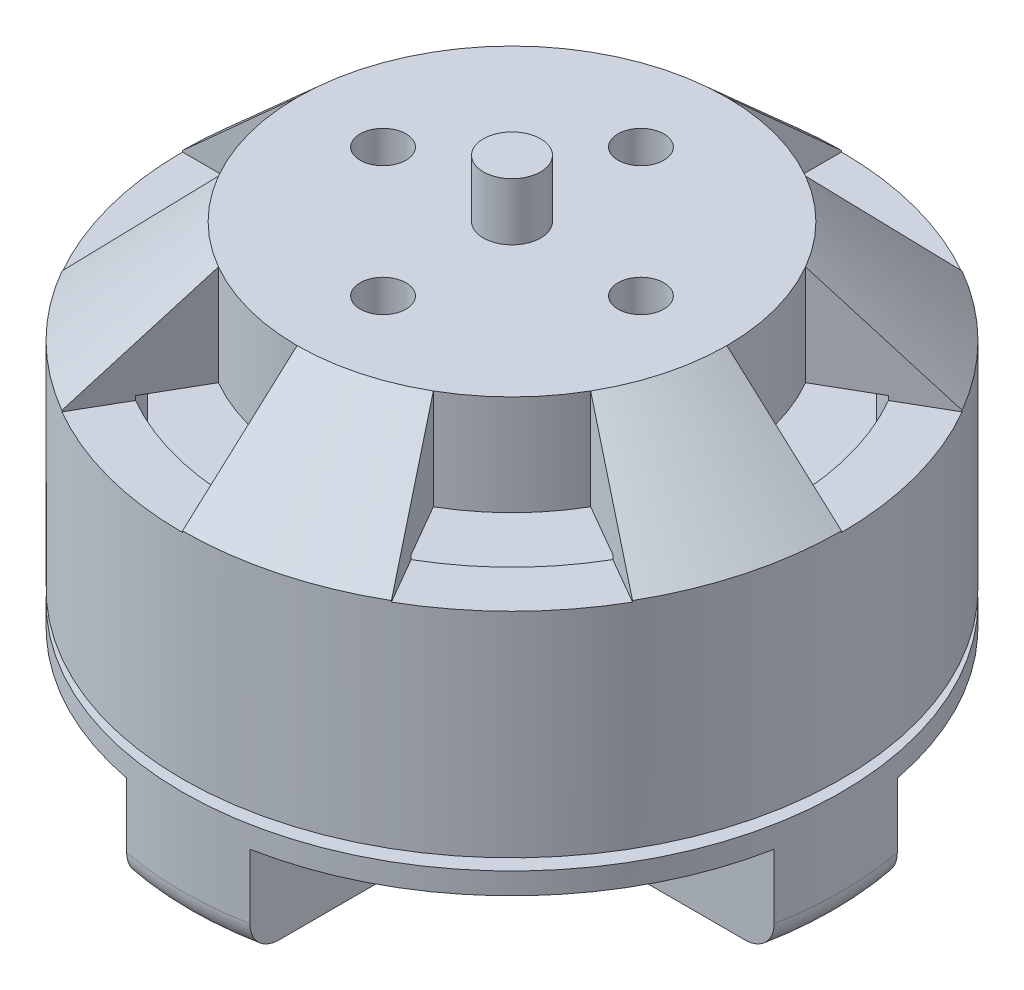
from build123d import *

# Parameters (mm, degrees)
SKETCH1_R                  = 11.5
BOSS_EXTRUDE1_DEPTH        = 4
BOSS_EXTRUDE2_DEPTH        = 6
SKETCH3_R                  = 1
CUT_EXTRUDE1_DEPTH         = 3.25
CUT_EXTRUDE2_START         = -3.65
CUT_EXTRUDE2_DEPTH         = 3.65
CUT_EXTRUDE3_DEPTH         = 0.75
FILLET1_R                  = 1
M2_TAPPED_HOLE1_AT_2_COUNT = 2
M2_TAPPED_HOLE1_AT_2_PITCH = 6.363961031
M2_TAPPED_HOLE1_AT_3_COUNT = 2
M2_TAPPED_HOLE1_AT_3_PITCH = 9
M2_TAPPED_HOLE1_AT_4_COUNT = 2
M2_TAPPED_HOLE1_AT_4_PITCH = 6.363961031


with BuildPart() as part:
    # Sketch1 → Boss-Extrude1 (new body)
    with BuildSketch(Plane(origin=(0, 0, 0), x_dir=(1, 0, 0), z_dir=(0, 1, 0))):
        with Locations(Location((0, 0, 0), (0, 0, 270))):
            Circle(SKETCH1_R)
    extrude(amount=BOSS_EXTRUDE1_DEPTH)

    # Sketch3 → Cut-Extrude1 (cut)
    with BuildSketch(Plane.XZ):
        with Locations(Location((0, 8, 0), (0, 0, 270))):
            Circle(SKETCH3_R)
        with Locations(Location((6, 0, 0), (0, 0, 270))):
            Circle(SKETCH3_R)
        with Locations(Location((0, -8, 0), (0, 0, 270))):
            Circle(SKETCH3_R)
        with Locations(Location((-6, 0, 0), (0, 0, 270))):
            Circle(SKETCH3_R)
        with BuildLine():
            Line((-2.15, 11.297234175), (-2.15, 4.65))
            ThreePointArc((-2.15, 4.65), (-2.882233047, 2.882233047), (-4.65, 2.15))
            Line((-4.65, 2.15), (-11.297234175, 2.15))
            ThreePointArc((-11.297234175, 2.15), (-8.131727984, 8.131727984), (-2.15, 11.297234175))
        make_face()
        with BuildLine():
            Line((2.15, 11.297234175), (2.15, 4.65))
            ThreePointArc((2.15, 4.65), (2.882233047, 2.882233047), (4.65, 2.15))
            Line((4.65, 2.15), (11.297234175, 2.15))
            ThreePointArc((11.297234175, 2.15), (8.131727984, 8.131727984), (2.15, 11.297234175))
        make_face()
        with BuildLine():
            Line((11.297234175, -2.15), (4.65, -2.15))
            ThreePointArc((4.65, -2.15), (2.882233047, -2.882233047), (2.15, -4.65))
            Line((2.15, -4.65), (2.15, -11.297234175))
            ThreePointArc((2.15, -11.297234175), (8.131727984, -8.131727984), (11.297234175, -2.15))
        make_face()
        with BuildLine():
            Line((-2.15, -4.65), (-2.15, -11.297234175))
            ThreePointArc((-2.15, -11.297234175), (-8.131727984, -8.131727984), (-11.297234175, -2.15))
            Line((-11.297234175, -2.15), (-4.65, -2.15))
            ThreePointArc((-4.65, -2.15), (-2.882233047, -2.882233047), (-2.15, -4.65))
        make_face()
    extrude(amount=-CUT_EXTRUDE1_DEPTH, mode=Mode.SUBTRACT)

    # Sketch9 → Cut-Extrude3 (cut)
    with BuildSketch(Plane.XZ.offset(-3.25)):
        with BuildLine():
            Line((-4.65, -2.15), (-9.253512846, -2.15))
            ThreePointArc((-9.253512846, -2.15), (-6.717514421, -6.717514421), (-2.15, -9.253512846))
            Line((-2.15, -9.253512846), (-2.15, -4.65))
            ThreePointArc((-2.15, -4.65), (-2.882233047, -2.882233047), (-4.65, -2.15))
        make_face()
        with BuildLine():
            Line((2.15, -4.65), (2.15, -9.253512846))
            ThreePointArc((2.15, -9.253512846), (6.717514421, -6.717514421), (9.253512846, -2.15))
            Line((9.253512846, -2.15), (4.65, -2.15))
            ThreePointArc((4.65, -2.15), (2.882233047, -2.882233047), (2.15, -4.65))
        make_face()
        with BuildLine():
            Line((4.65, 2.15), (9.253512846, 2.15))
            ThreePointArc((9.253512846, 2.15), (6.717514421, 6.717514421), (2.15, 9.253512846))
            Line((2.15, 9.253512846), (2.15, 4.65))
            ThreePointArc((2.15, 4.65), (2.882233047, 2.882233047), (4.65, 2.15))
        make_face()
        with BuildLine():
            Line((-2.15, 4.65), (-2.15, 9.253512846))
            ThreePointArc((-2.15, 9.253512846), (-6.717514421, 6.717514421), (-9.253512846, 2.15))
            Line((-9.253512846, 2.15), (-4.65, 2.15))
            ThreePointArc((-4.65, 2.15), (-2.882233047, 2.882233047), (-2.15, 4.65))
        make_face()
    extrude(amount=-CUT_EXTRUDE3_DEPTH, mode=Mode.SUBTRACT)

    # Fillet1
    fillet1_edges = [part.edges().sort_by_distance(p)[0] for p in [
        (11.5, 0, 0),
        (0, 0, -11.5),
        (-11.5, 0, 0),
        (1.079770112, 0, 11.449196326),
    ]]
    fillet(fillet1_edges, radius=FILLET1_R)


with BuildPart() as body_2:
    # Sketch2 → Boss-Extrude2 (new body)
    with BuildSketch(Plane(origin=(0, 4, 0), x_dir=(1, 0, 0), z_dir=(0, 1, 0))):
        Polygon((0, -9.317485624), (4.658742812, -8.06917925), (8.06917925, -4.658742812), (9.317485624, 0), (8.06917925, 4.658742812), (4.658742812, 8.06917925), (0, 9.317485624), (-4.658742812, 8.06917925), (-8.06917925, 4.658742812), (-9.317485624, 0), (-8.06917925, -4.658742812), (-4.658742812, -8.06917925), align=None)
    extrude(amount=BOSS_EXTRUDE2_DEPTH)


with BuildPart() as body_3:
    # Sketch4 → Revolve2 (revolve)
    with BuildSketch(Plane(origin=(0, 0, 0), x_dir=(0, 0, -1), z_dir=(1, 0, 0))):
        Polygon((-11.5, 4.397620361), (-11.5, 11.897620361), (-7.5, 15.5), (-1, 15.5), (-1, 17.5), (0, 17.5), (0, 15.5), (0, 11), (0, 10), (-1, 10), (-1, 12), (-9.617485624, 12), (-9.617485624, 4.397620361), align=None)
    revolve(axis=Axis((0, 19.11668492, 0), (0, -1, 0)))

    # Sketch6 → Cut-Extrude2 (cut)
    with BuildSketch(Plane(origin=(0, 15.5, 0), x_dir=(1, 0, 0), z_dir=(0, 1, 0)).offset(CUT_EXTRUDE2_START)):
        with BuildLine():
            Line((0, 7.5), (0, 11.5))
            ThreePointArc((0, 11.5), (2.976419019, 11.108147002), (5.75, 9.959292144))
            Line((5.75, 9.959292144), (3.75, 6.495190528))
            ThreePointArc((3.75, 6.495190528), (1.941142838, 7.244443697), (0, 7.5))
        make_face()
        with BuildLine():
            Line((-3.75, 6.495190528), (-5.75, 9.959292144))
            ThreePointArc((-5.75, 9.959292144), (-8.131727984, 8.131727984), (-9.959292144, 5.75))
            Line((-9.959292144, 5.75), (-6.495190528, 3.75))
            ThreePointArc((-6.495190528, 3.75), (-5.303300859, 5.303300859), (-3.75, 6.495190528))
        make_face()
        with BuildLine():
            Line((-11.5, 0), (-7.5, 0))
            ThreePointArc((-7.5, 0), (-7.244443697, -1.941142838), (-6.495190528, -3.75))
            Line((-6.495190528, -3.75), (-9.959292144, -5.75))
            ThreePointArc((-9.959292144, -5.75), (-11.108147002, -2.976419019), (-11.5, 0))
        make_face()
        with BuildLine():
            Line((-3.75, -6.495190528), (-5.75, -9.959292144))
            ThreePointArc((-5.75, -9.959292144), (-2.976419019, -11.108147002), (0, -11.5))
            Line((0, -11.5), (0, -7.5))
            ThreePointArc((0, -7.5), (-1.941142838, -7.244443697), (-3.75, -6.495190528))
        make_face()
        with BuildLine():
            Line((3.75, -6.495190528), (5.75, -9.959292144))
            ThreePointArc((5.75, -9.959292144), (8.131727984, -8.131727984), (9.959292144, -5.75))
            Line((9.959292144, -5.75), (6.495190528, -3.75))
            ThreePointArc((6.495190528, -3.75), (5.303300859, -5.303300859), (3.75, -6.495190528))
        make_face()
        with BuildLine():
            Line((7.5, 0), (11.5, 0))
            ThreePointArc((11.5, 0), (11.108147002, 2.976419019), (9.959292144, 5.75))
            Line((9.959292144, 5.75), (6.495190528, 3.75))
            ThreePointArc((6.495190528, 3.75), (7.244443697, 1.941142838), (7.5, 0))
        make_face()
    extrude(amount=CUT_EXTRUDE2_DEPTH, mode=Mode.SUBTRACT)

    # Sketch10 → M2 Tapped Hole1 (revolve, cut)
    with BuildSketch(Plane(origin=(-4.5, 15.5, 0), x_dir=(0, 0, 1), z_dir=(1, 0, 0))):
        Polygon((0, 0), (0, 3.780688495), (0.8, 3.3), (0.8, 0), align=None)
    m2_tapped_hole1 = revolve(axis=Axis((-4.5, 21.85, 0), (0, -1, 0)), mode=Mode.SUBTRACT)

    # M2 Tapped Hole1 at 2: M2 Tapped Hole1 ×2
    with Locations(*[Vector(0.7071067811865475, 0, -0.7071067811865477) * (i * M2_TAPPED_HOLE1_AT_2_PITCH) for i in range(1, M2_TAPPED_HOLE1_AT_2_COUNT)]):
        add(m2_tapped_hole1, mode=Mode.SUBTRACT)

    # M2 Tapped Hole1 at 3: M2 Tapped Hole1 ×2
    with Locations(*[(i * M2_TAPPED_HOLE1_AT_3_PITCH, 0, 0) for i in range(1, M2_TAPPED_HOLE1_AT_3_COUNT)]):
        add(m2_tapped_hole1, mode=Mode.SUBTRACT)

    # M2 Tapped Hole1 at 4: M2 Tapped Hole1 ×2
    with Locations(*[Vector(0.7071067811865475, 0, 0.7071067811865477) * (i * M2_TAPPED_HOLE1_AT_4_PITCH) for i in range(1, M2_TAPPED_HOLE1_AT_4_COUNT)]):
        add(m2_tapped_hole1, mode=Mode.SUBTRACT)


solid = Compound([part.part, body_2.part, body_3.part])
